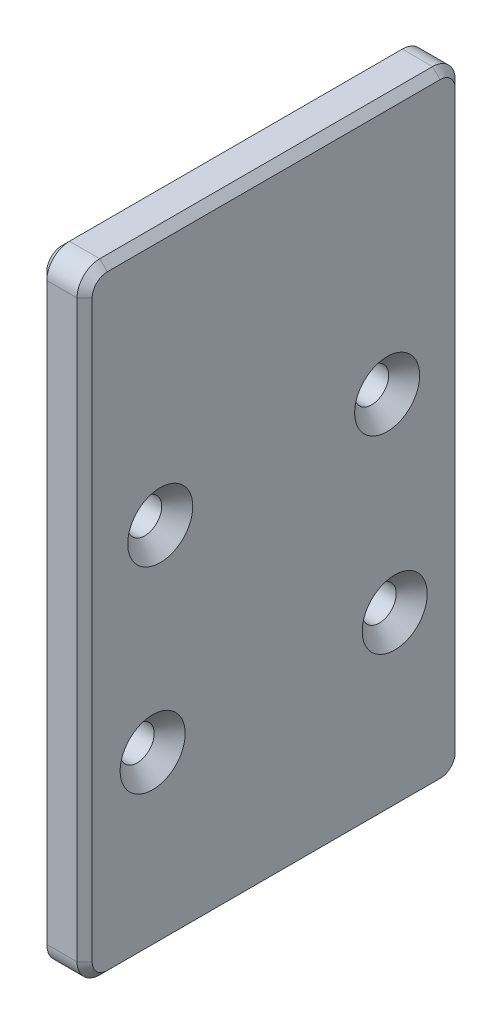
from build123d import *

# Parameters (mm, degrees)
SKETCH_1_W                   = 50
SKETCH_1_H                   = 82
EXTRUDE_1_DEPTH              = 6
FILLET_1_R                   = 3
CHAMFER_1_SIZE               = 1
HOLE_WIZARD_M4_1_D           = 4.5
HOLE_WIZARD_M4_1_CSINK_D     = 8.6
HOLE_WIZARD_M4_1_CSINK_ANGLE = 90


with BuildPart() as part:
    # 草图1 → 凸台-拉伸1 (new body)
    with BuildSketch(Plane(origin=(0, 0, 0), x_dir=(0, 0, -1), z_dir=(1, 0, 0))):
        Rectangle(SKETCH_1_W, SKETCH_1_H)
    extrude(amount=EXTRUDE_1_DEPTH)

    # 圆角1
    fillet_1_edges = [part.edges().sort_by_distance(p)[0] for p in [
        (3, -41, -25),
        (3, -41, 25),
        (3, 41, 25),
        (3, 41, -25),
    ]]
    fillet(fillet_1_edges, radius=FILLET_1_R)

    # 倒角1
    chamfer_1_edges = [part.edges().sort_by_distance(p)[0] for p in [
        (0, -41, 0),
        (6, -41, 0),
        (0, 0, -25),
        (0, 0, 25),
        (0, 41, 0),
        (0, 40.121320344, -24.121320344),
        (0, 40.121320344, 24.121320344),
        (0, -40.121320344, -24.121320344),
        (0, -40.121320344, 24.121320344),
        (6, 0, 25),
        (6, 0, -25),
        (6, 41, 0),
        (6, 40.121320344, -24.121320344),
        (6, 40.121320344, 24.121320344),
        (6, -40.121320344, -24.121320344),
        (6, -40.121320344, 24.121320344),
    ]]
    chamfer(chamfer_1_edges, length=CHAMFER_1_SIZE)

    # M4 十字槽沉头木螺钉的锥形沉头孔1 (through all)
    with Locations(Plane(origin=(6, 0, 0), x_dir=(0, 0, -1), z_dir=(1, 0, 0))):
        with Locations((15, 7.5), (-15, 7.5), (16, -18), (-16, -18)):
            CounterSinkHole(HOLE_WIZARD_M4_1_D / 2, HOLE_WIZARD_M4_1_CSINK_D / 2, counter_sink_angle=HOLE_WIZARD_M4_1_CSINK_ANGLE)


solid = part.part
